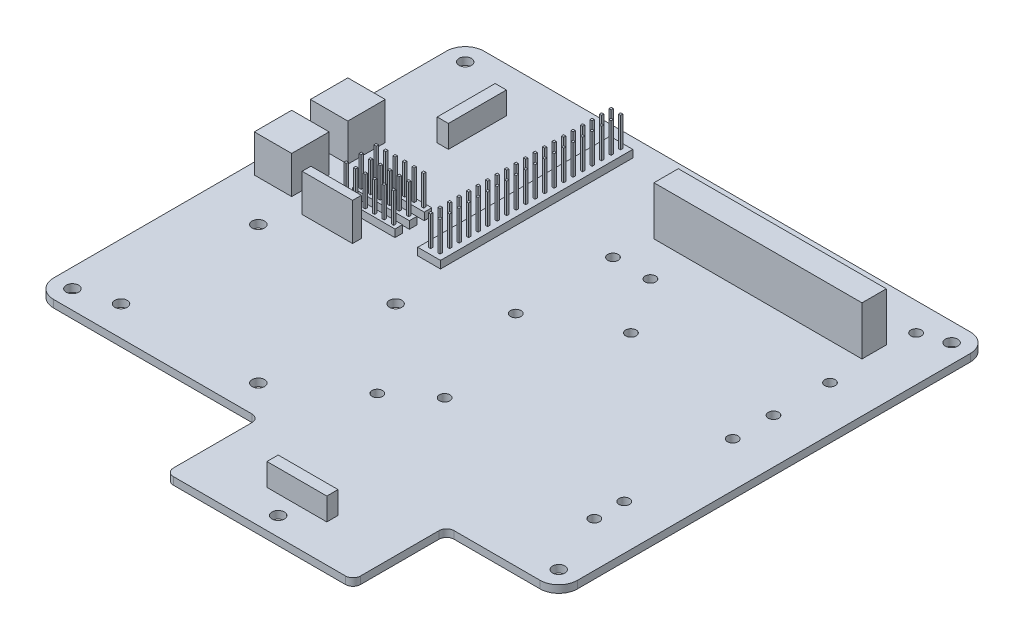
from build123d import *

# Parameters (mm, degrees)
SKETCH2_W            = 140
SKETCH2_H            = 115
BOSS_EXTRUDE1_DEPTH  = 2
SKETCH7_R            = 1.4
CUT_EXTRUDE1_DEPTH   = 10
SKETCH9_W            = 50
SKETCH9_H            = 25
BOSS_EXTRUDE2_DEPTH  = 2
SKETCH11_R           = 1.4
CUT_EXTRUDE2_DEPTH   = 124.810338825
SKETCH12_W           = 55.6
SKETCH12_H           = 6.5
BOSS_EXTRUDE3_DEPTH  = 13
SKETCH17_W           = 0.6
SKETCH17_H           = 0.6
BOSS_EXTRUDE7_DEPTH  = 10
LPATTERN1_COUNT      = 20
LPATTERN1_PITCH      = 2.54
LPATTERN1_COUNT_DIR2 = 2
LPATTERN1_PITCH_DIR2 = 2.54
SKETCH20_R           = 1.65
CUT_EXTRUDE5_DEPTH   = 125.474897068
SKETCH21_W           = 13.478976636
SKETCH21_H           = 2.344169849
BOSS_EXTRUDE9_DEPTH  = 10
SKETCH22_W           = 6.085513756
SKETCH22_H           = 51.38775216
BOSS_EXTRUDE10_DEPTH = 2
SKETCH23_R           = 1.65
CUT_EXTRUDE6_DEPTH   = 2
FILLET1_R            = 5
FILLET2_R            = 2
SKETCH24_W           = 10
SKETCH24_H           = 10
BOSS_EXTRUDE11_DEPTH = 10
SKETCH25_W           = 3
SKETCH25_H           = 15.5
SKETCH25_W_2         = 16
SKETCH25_H_2         = 3
BOSS_EXTRUDE12_DEPTH = 6
SKETCH26_W           = 0.6
SKETCH26_H           = 0.6
BOSS_EXTRUDE13_DEPTH = 10
LPATTERN2_COUNT      = 6
LPATTERN2_PITCH      = 2.54
LPATTERN2_COUNT_DIR2 = 3
LPATTERN2_PITCH_DIR2 = 4
SKETCH27_W           = 15.245940943
SKETCH27_H           = 2
BOSS_EXTRUDE14_DEPTH = 2
LPATTERN3_COUNT      = 2
LPATTERN3_PITCH      = 15


with BuildPart() as part:
    # Sketch2 → Boss-Extrude1 (new body)
    with BuildSketch(Plane(origin=(0, 0, 0), x_dir=(1, 0, 0), z_dir=(0, 1, 0))):
        with Locations((-15, -7.5)):
            Rectangle(SKETCH2_W, SKETCH2_H)
    extrude(amount=BOSS_EXTRUDE1_DEPTH)

    # Sketch7 → Cut-Extrude1 (cut)
    with BuildSketch(Plane(origin=(0, 2, 0), x_dir=(1, 0, 0), z_dir=(0, 1, 0))):
        with Locations(Location((-15, 42.5, 0), (0, 0, 270))):
            Circle(SKETCH7_R)
        with Locations(Location((43, 42.5, 0), (0, 0, 270))):
            Circle(SKETCH7_R)
        with Locations(Location((-15, -6.5, 0), (0, 0, 270))):
            Circle(SKETCH7_R)
        with Locations(Location((43, -6.5, 0), (0, 0, 270))):
            Circle(SKETCH7_R)
        with Locations(Location((-15, 19.5, 0), (0, 0, 270))):
            Circle(SKETCH7_R)
        with Locations(Location((43, 19.5, 0), (0, 0, 270))):
            Circle(SKETCH7_R)
        with Locations(Location((-15, -43.5, 0), (0, 0, 270))):
            Circle(SKETCH7_R)
        with Locations(Location((43, -43.5, 0), (0, 0, 270))):
            Circle(SKETCH7_R)
    extrude(amount=-CUT_EXTRUDE1_DEPTH, mode=Mode.SUBTRACT)

    # Sketch9 → Boss-Extrude2 (add)
    with BuildSketch(Plane(origin=(0, 2, 0), x_dir=(1, 0, 0), z_dir=(0, 1, 0))):
        with Locations((0, -77.5)):
            Rectangle(SKETCH9_W, SKETCH9_H)
    extrude(amount=-BOSS_EXTRUDE2_DEPTH)

    # Sketch11 → Cut-Extrude2 (cut, through all)
    with BuildSketch(Plane(origin=(0, 2, 0), x_dir=(1, 0, 0), z_dir=(0, 1, 0))):
        with Locations(Location((-5, 19.5, 0), (0, 0, 270))):
            Circle(SKETCH11_R)
        with Locations(Location((4.9, 42.5, 0), (0, 0, 270))):
            Circle(SKETCH11_R)
        with Locations(Location((4.9, 4.4, 0), (0, 0, 270))):
            Circle(SKETCH11_R)
        with Locations(Location((-5, -35.5, 0), (0, 0, 270))):
            Circle(SKETCH11_R)
        with Locations(Location((43, -35.5, 0), (0, 0, 270))):
            Circle(SKETCH11_R)
        with Locations(Location((43, 4.4, 0), (0, 0, 270))):
            Circle(SKETCH11_R)
    extrude(amount=-CUT_EXTRUDE2_DEPTH, mode=Mode.SUBTRACT)

    # Sketch12 → Boss-Extrude3 (add)
    with BuildSketch(Plane(origin=(0, 2, 0), x_dir=(1, 0, 0), z_dir=(0, 1, 0))):
        with Locations((14, 32.5)):
            Rectangle(SKETCH12_W, SKETCH12_H)
    extrude(amount=BOSS_EXTRUDE3_DEPTH)

    # Sketch17 → Boss-Extrude7 (add)
    with BuildSketch(Plane(origin=(0, 2, 0), x_dir=(1, 0, 0), z_dir=(0, 1, 0))):
        with Locations((-39.7, 43.7)):
            Rectangle(SKETCH17_W, SKETCH17_H)
    boss_extrude7 = extrude(amount=BOSS_EXTRUDE7_DEPTH)

    # LPattern1: Boss-Extrude7 20 × 2
    with Locations(*[(j * LPATTERN1_PITCH_DIR2, 0, i * LPATTERN1_PITCH) for i in range(LPATTERN1_COUNT) for j in range(LPATTERN1_COUNT_DIR2) if (i, j) != (0, 0)]):
        add(boss_extrude7)

    # Sketch20 → Cut-Extrude5 (cut, through all)
    with BuildSketch(Plane(origin=(0, 2, 0), x_dir=(1, 0, 0), z_dir=(0, 1, 0))):
        with Locations(Location((-70, -20.3, 0), (0, 0, 270))):
            Circle(SKETCH20_R)
        with Locations(Location((-33.3, -20.3, 0), (0, 0, 270))):
            Circle(SKETCH20_R)
        with Locations(Location((-70, -57, 0), (0, 0, 270))):
            Circle(SKETCH20_R)
        with Locations(Location((-33.3, -57, 0), (0, 0, 270))):
            Circle(SKETCH20_R)
    extrude(amount=-CUT_EXTRUDE5_DEPTH, mode=Mode.SUBTRACT)

    # Sketch21 → Boss-Extrude9 (add)
    with BuildSketch(Plane(origin=(0, 2, 0), x_dir=(1, 0, 0), z_dir=(0, 1, 0))):
        with Locations((-59.741894721, -10.943255061)):
            Rectangle(SKETCH21_W, SKETCH21_H)
    extrude(amount=BOSS_EXTRUDE9_DEPTH)

    # Sketch22 → Boss-Extrude10 (add)
    with BuildSketch(Plane(origin=(0, 2, 0), x_dir=(1, 0, 0), z_dir=(0, 1, 0))):
        with Locations((-38.397972124, 19.440743892)):
            Rectangle(SKETCH22_W, SKETCH22_H)
    extrude(amount=BOSS_EXTRUDE10_DEPTH)

    # Sketch23 → Cut-Extrude6 (cut)
    with BuildSketch(Plane(origin=(0, 2, 0), x_dir=(1, 0, 0), z_dir=(0, 1, 0))):
        with Locations(Location((-80, 45, 0), (0, 0, 270))):
            Circle(SKETCH23_R)
        with Locations(Location((50, 45, 0), (0, 0, 270))):
            Circle(SKETCH23_R)
        with Locations(Location((50, -60, 0), (0, 0, 270))):
            Circle(SKETCH23_R)
        with Locations(Location((-80, -60, 0), (0, 0, 270))):
            Circle(SKETCH23_R)
        with Locations(Location((0, -85, 0), (0, 0, 270))):
            Circle(SKETCH23_R)
    extrude(amount=-CUT_EXTRUDE6_DEPTH, mode=Mode.SUBTRACT)

    # Fillet1
    fillet1_edges = [part.edges().sort_by_distance(p)[0] for p in [
        (-85, 1, -50),
        (55, 1, -50),
        (55, 1, 65),
        (-85, 1, 65),
    ]]
    fillet(fillet1_edges, radius=FILLET1_R)

    # Fillet2
    fillet2_edges = [part.edges().sort_by_distance(p)[0] for p in [
        (-25, 1, 90),
        (-25, 1, 65),
        (25, 1, 65),
        (25, 1, 90),
    ]]
    fillet(fillet2_edges, radius=FILLET2_R)

    # Sketch24 → Boss-Extrude11 (add)
    with BuildSketch(Plane(origin=(0, 2, 0), x_dir=(1, 0, 0), z_dir=(0, 1, 0))):
        with Locations((-77, 10.616682417)):
            Rectangle(SKETCH24_W, SKETCH24_H)
    boss_extrude11 = extrude(amount=BOSS_EXTRUDE11_DEPTH)

    # Sketch25 → Boss-Extrude12 (add)
    with BuildSketch(Plane(origin=(0, 2, 0), x_dir=(1, 0, 0), z_dir=(0, 1, 0))):
        with Locations((-63.5, 30.25)):
            Rectangle(SKETCH25_W, SKETCH25_H)
        with Locations((0, -78.5)):
            Rectangle(SKETCH25_W_2, SKETCH25_H_2)
    extrude(amount=BOSS_EXTRUDE12_DEPTH)

    # Sketch26 → Boss-Extrude13 (add)
    with BuildSketch(Plane(origin=(0, 2, 0), x_dir=(1, 0, 0), z_dir=(0, 1, 0))):
        with Locations((-62.70806363, 3.8967572)):
            Rectangle(SKETCH26_W, SKETCH26_H)
    boss_extrude13 = extrude(amount=BOSS_EXTRUDE13_DEPTH)

    # LPattern2: Boss-Extrude13 6 × 3
    with Locations(*[(i * LPATTERN2_PITCH, 0, j * LPATTERN2_PITCH_DIR2) for i in range(LPATTERN2_COUNT) for j in range(LPATTERN2_COUNT_DIR2) if (i, j) != (0, 0)]):
        add(boss_extrude13)

    # Sketch27 → Boss-Extrude14 (add)
    with BuildSketch(Plane(origin=(0, 2, 0), x_dir=(1, 0, 0), z_dir=(0, 1, 0))):
        with Locations((-56.329041305, 3.754806723)):
            Rectangle(SKETCH27_W, SKETCH27_H)
        with Locations((-56.329041305, -0.225910772)):
            Rectangle(SKETCH27_W, SKETCH27_H)
        with Locations((-56.329041305, -4.075350909)):
            Rectangle(SKETCH27_W, SKETCH27_H)
    extrude(amount=BOSS_EXTRUDE14_DEPTH)

    # LPattern3: Boss-Extrude11 ×2
    with Locations(*[(0, 0, i * LPATTERN3_PITCH) for i in range(1, LPATTERN3_COUNT)]):
        add(boss_extrude11)


solid = part.part
